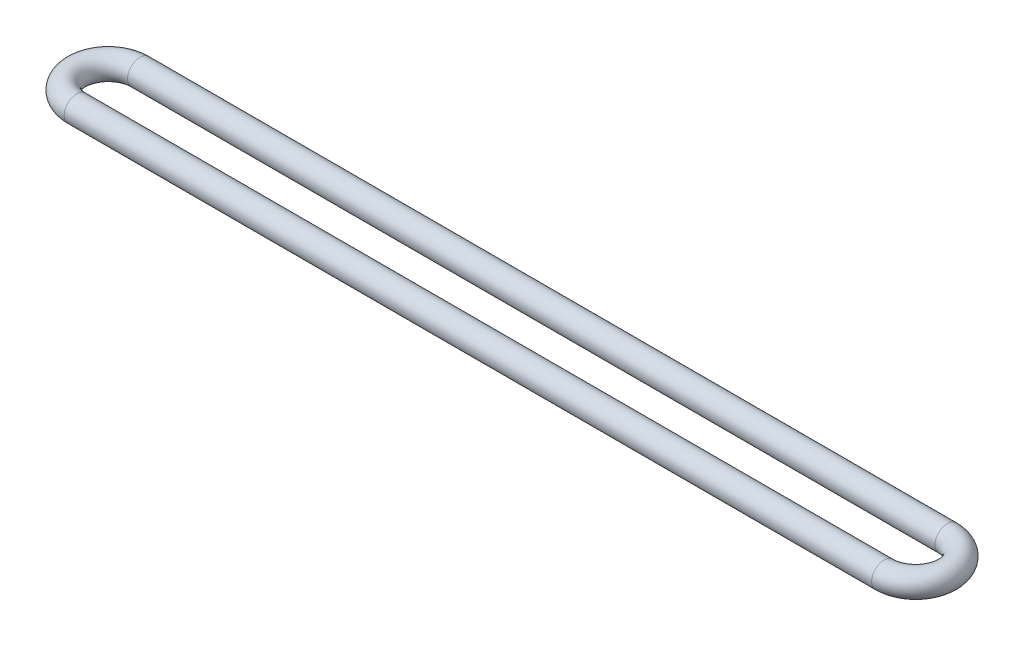
from build123d import *

# Parameters (mm, degrees)
SKETCH2_R = 1


with BuildPart() as part:
    # Sweep1: sweep along a path in Sketch1
    with BuildLine(Plane(origin=(0, 0, 0), x_dir=(1, 0, 0), z_dir=(0, 1, 0))) as sweep1_path:
        Line((0, 0), (65, 0))
        ThreePointArc((65, 0), (67.55, -2.55), (65, -5.1))
        Line((65, -5.1), (0, -5.1))
        ThreePointArc((0, -5.1), (-2.55, -2.55), (0, 0))
    # Sketch2 → Sweep1 (sweep)
    with BuildSketch(Plane(origin=(0, 0, 0), x_dir=(0, 0, -1), z_dir=(1, 0, 0))):
        Circle(SKETCH2_R)
    sweep(path=sweep1_path.line)


solid = part.part
